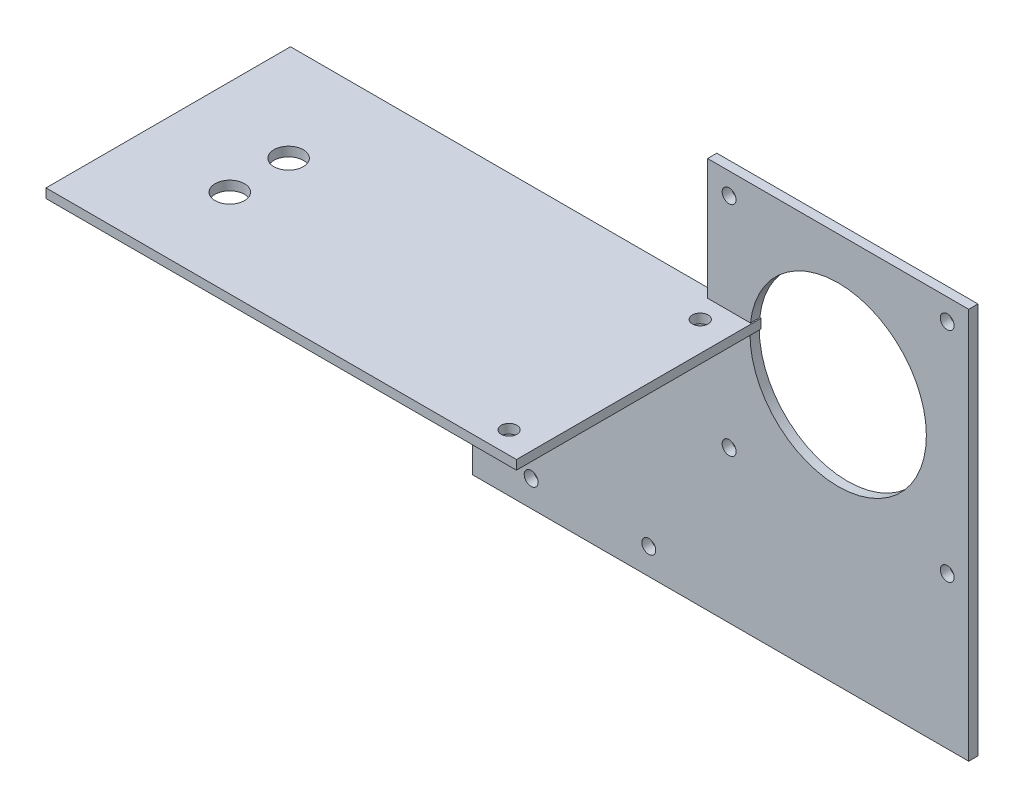
from build123d import *

# Parameters (mm, degrees)
SKETCH1_R           = 1.5
SKETCH1_R_2         = 19.05
BOSS_EXTRUDE1_DEPTH = 2
BOSS_EXTRUDE2_DEPTH = 52.8
SKETCH3_R           = 1.7
CUT_EXTRUDE1_DEPTH  = 133.22344724
SKETCH4_R           = 3.175
CUT_EXTRUDE2_DEPTH  = 10


with BuildPart() as part:
    # Sketch1 → Boss-Extrude1 (new body)
    with BuildSketch(Plane.XY):
        Polygon((0, 58.4), (0, 0), (107.2, 0), (107.2, 84.53204182), (50.8, 84.53204182), (50.8, 58.4), align=None)
        with Locations((102.55, 79.88204182)):
            Circle(SKETCH1_R, mode=Mode.SUBTRACT)
        with Locations((102.55, 32.78204182)):
            Circle(SKETCH1_R, mode=Mode.SUBTRACT)
        with Locations((55.45, 32.78204182)):
            Circle(SKETCH1_R, mode=Mode.SUBTRACT)
        with Locations((55.45, 79.88204182)):
            Circle(SKETCH1_R, mode=Mode.SUBTRACT)
        with Locations((12.7, 52.75)):
            Circle(SKETCH1_R, mode=Mode.SUBTRACT)
        with Locations((38.1, 52.75)):
            Circle(SKETCH1_R, mode=Mode.SUBTRACT)
        with Locations((12.7, 5.65)):
            Circle(SKETCH1_R, mode=Mode.SUBTRACT)
        with Locations((38.1, 5.65)):
            Circle(SKETCH1_R, mode=Mode.SUBTRACT)
        with Locations((79, 56.33204182)):
            Circle(SKETCH1_R_2, mode=Mode.SUBTRACT)
    extrude(amount=-BOSS_EXTRUDE1_DEPTH)

    # Sketch2 → Boss-Extrude2 (add)
    with BuildSketch(Plane(origin=(0, 0, -2), x_dir=(-1, 0, 0), z_dir=(0, 0, -1))):
        Polygon((0, 58.4), (41.275, 58.4), (41.275, 56.4), (0, 56.4), (-60.325, 56.4), (-60.325, 58.4), align=None)
    extrude(amount=-BOSS_EXTRUDE2_DEPTH)

    # Sketch3 → Cut-Extrude1 (cut, through all)
    with BuildSketch(Plane(origin=(0, 58.4, 0), x_dir=(1, 0, 0), z_dir=(0, 1, 0))):
        with Locations(Location((53.975, -4.7625, 0), (0, 0, 180))):
            Circle(SKETCH3_R)
        with Locations(Location((53.975, -46.0375, 0), (0, 0, 180))):
            Circle(SKETCH3_R)
    extrude(amount=-CUT_EXTRUDE1_DEPTH, mode=Mode.SUBTRACT)

    # Sketch4 → Cut-Extrude2 (cut)
    with BuildSketch(Plane(origin=(0, 58.4, 0), x_dir=(1, 0, 0), z_dir=(0, 1, 0))):
        with Locations(Location((-20.6375, -19.05, 0), (0, 0, 180))):
            Circle(SKETCH4_R)
        with Locations(Location((-20.6375, -31.75, 0), (0, 0, 180))):
            Circle(SKETCH4_R)
    extrude(amount=-CUT_EXTRUDE2_DEPTH, mode=Mode.SUBTRACT)


solid = part.part
